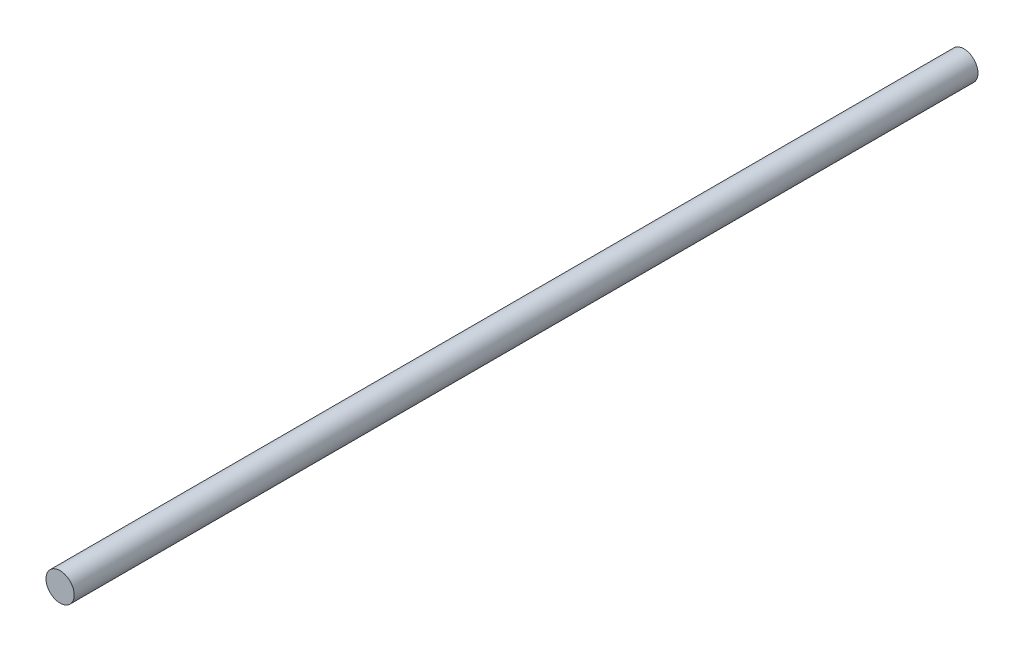
from build123d import *

# Parameters (mm, degrees)
SKETCH2_R = 2.54


with BuildPart() as part:
    # Sweep3: sweep along a path in Sketch1
    with BuildLine(Plane(origin=(0, 0, 0), x_dir=(1, 0, 0), z_dir=(0, 1, 0))) as sweep3_path:
        Line((0, 0), (0, 162.814))
    # Sketch2 → Sweep3 (sweep)
    with BuildSketch(Plane.XY):
        Circle(SKETCH2_R)
    sweep(path=sweep3_path.line)


solid = part.part
